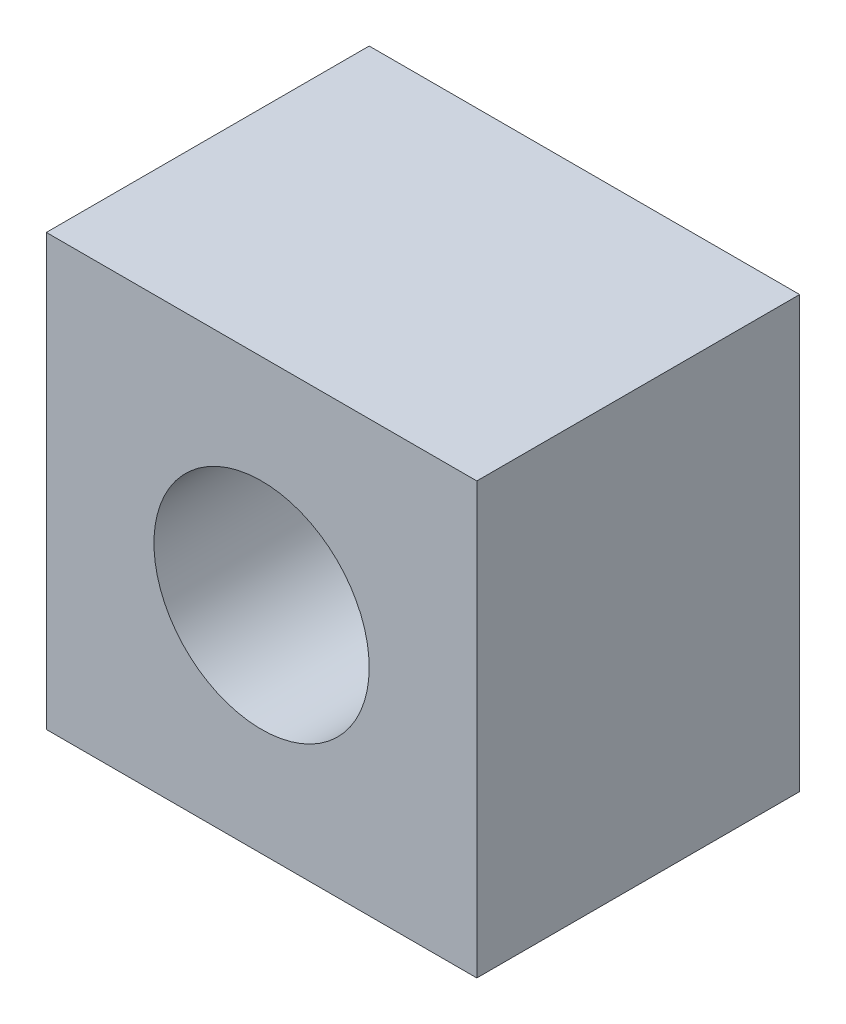
from build123d import *

# Parameters (mm, degrees)
ESQUISSE1_W                                        = 12
ESQUISSE1_H                                        = 12
ESQUISSE1_R                                        = 3
BOSS_EXTRU_1_DEPTH                                 = 6
ESQUISSE2_W                                        = 12
ESQUISSE2_H                                        = 12
BOSS_EXTRU_2_DEPTH                                 = 3
CHAMBRAGE_POUR_VIS_T_TE_RONDE_BOMB_E_M_D           = 3.4
CHAMBRAGE_POUR_VIS_T_TE_RONDE_BOMB_E_M_DEPTH       = 6.35
CHAMBRAGE_POUR_VIS_T_TE_RONDE_BOMB_E_M_CBORE_D     = 7
CHAMBRAGE_POUR_VIS_T_TE_RONDE_BOMB_E_M_CBORE_DEPTH = 2.4


with BuildPart() as part:
    # Esquisse1 → Boss.-Extru.1 (new body)
    with BuildSketch(Plane.XY):
        Rectangle(ESQUISSE1_W, ESQUISSE1_H)
        Circle(ESQUISSE1_R, mode=Mode.SUBTRACT)
    extrude(amount=BOSS_EXTRU_1_DEPTH)

    # Esquisse2 → Boss.-Extru.2 (add)
    with BuildSketch(Plane(origin=(0, 0, 0), x_dir=(-1, 0, 0), z_dir=(0, 0, -1))):
        Rectangle(ESQUISSE2_W, ESQUISSE2_H)
    extrude(amount=BOSS_EXTRU_2_DEPTH)

    # Chambrage pour vis à tête ronde bombée M31
    with Locations(Plane(origin=(0, 0, -3), x_dir=(-1, 0, 0), z_dir=(0, 0, -1))):
        with Locations((0, 0)):
            CounterBoreHole(CHAMBRAGE_POUR_VIS_T_TE_RONDE_BOMB_E_M_D / 2, CHAMBRAGE_POUR_VIS_T_TE_RONDE_BOMB_E_M_CBORE_D / 2, CHAMBRAGE_POUR_VIS_T_TE_RONDE_BOMB_E_M_CBORE_DEPTH, depth=CHAMBRAGE_POUR_VIS_T_TE_RONDE_BOMB_E_M_DEPTH)


solid = part.part
